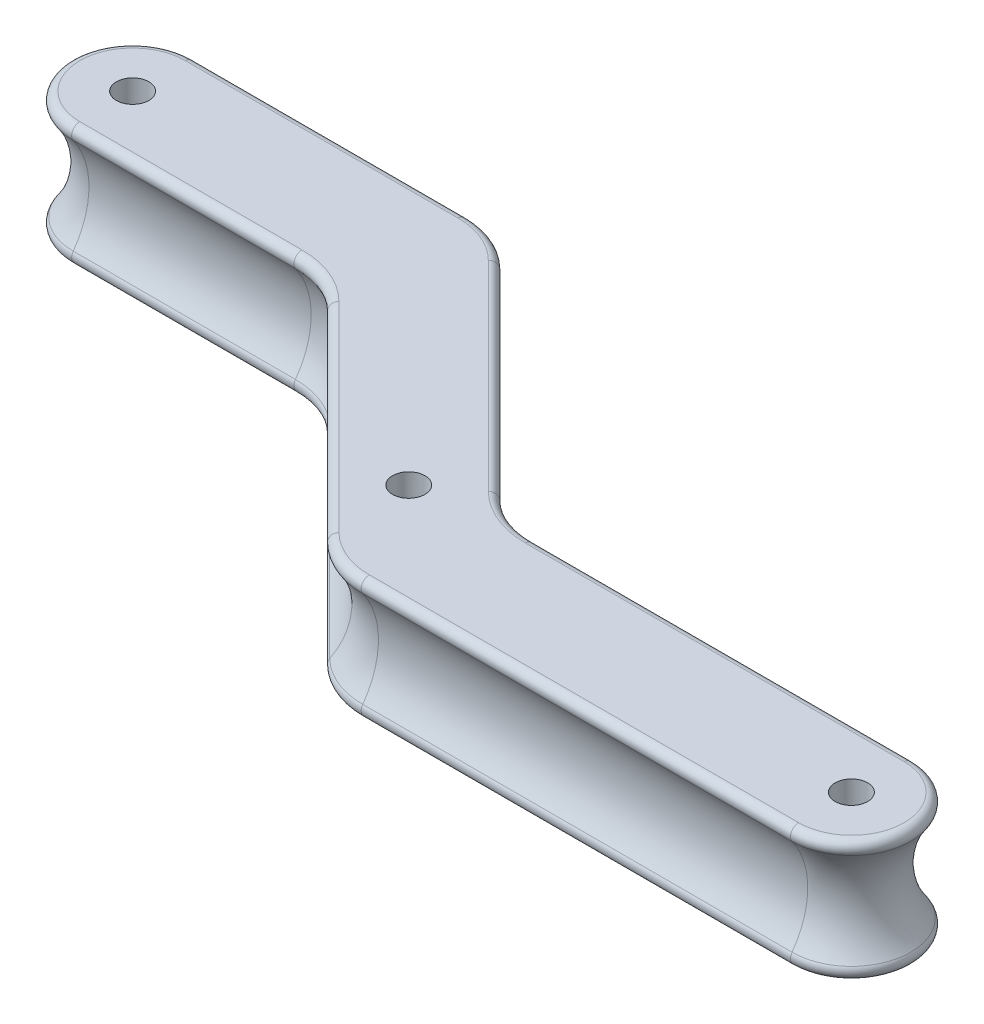
from build123d import *

# Parameters (mm, degrees)
EXTRUDE_1_DEPTH     = 7.5
SKETCH_2_R          = 2
CUT_EXTRUDE_1_DEPTH = 195.977562812
FILLET_1_R          = 10


with BuildPart() as part:
    # 草图1 → 凸台-拉伸1 (new, symmetric)
    with BuildSketch(Plane(origin=(0, 0, 0), x_dir=(1, 0, 0), z_dir=(0, 1, 0))):
        with BuildLine():
            Line((-181.5, 30.5), (-150, 30.5))
            Line((-150, 30.5), (-119.5, 0))
            Line((-119.5, 0), (-62.5, 0))
            ThreePointArc((-62.5, 0), (-55, 7.5), (-62.5, 15))
            Line((-62.5, 15), (-113.286796564, 15))
            Line((-113.286796564, 15), (-143.786796564, 45.5))
            Line((-143.786796564, 45.5), (-181.5, 45.5))
            ThreePointArc((-181.5, 45.5), (-189, 38), (-181.5, 30.5))
        make_face()
    extrude(amount=EXTRUDE_1_DEPTH, both=True)

    # 草图2 → 切除-拉伸1 (cut, through all)
    with BuildSketch(Plane(origin=(0, 7.5, 0), x_dir=(1, 0, 0), z_dir=(0, 1, 0))):
        with Locations(Location((-62.5, 7.5, 0), (0, 0, 270))):
            Circle(SKETCH_2_R)
        with Locations(Location((-181.5, 38, 0), (0, 0, 270))):
            Circle(SKETCH_2_R)
        with Locations(Location((-122.5, 13, 0), (0, 0, 270))):
            Circle(SKETCH_2_R)
    extrude(amount=-CUT_EXTRUDE_1_DEPTH, mode=Mode.SUBTRACT)

    # 圆角1
    fillet_1_edges = [part.edges().sort_by_distance(p)[0] for p in [
        (-143.786796564, 0, -45.5),
        (-113.286796564, 0, -15),
        (-119.5, 0, 0),
        (-150, 0, -30.5),
    ]]
    fillet(fillet_1_edges, radius=FILLET_1_R)

    # 切除-扫描1: sweep along a path in 草图4
    with BuildLine(Plane(origin=(0, 7.5, 0), x_dir=(1, 0, 0), z_dir=(0, 1, 0))) as sweep_1_path:
        Line((-62.5, 15), (-109.144660941, 15))
        ThreePointArc((-109.144660941, 15), (-112.971495264, 15.761204675), (-116.215728753, 17.928932188))
        Line((-116.215728753, 17.928932188), (-140.857864376, 42.571067812))
        ThreePointArc((-140.857864376, 42.571067812), (-144.102097864, 44.738795325), (-147.928932188, 45.5))
        Line((-147.928932188, 45.5), (-181.5, 45.5))
        ThreePointArc((-181.5, 45.5), (-189, 38), (-181.5, 30.5))
        Line((-181.5, 30.5), (-154.142135624, 30.5))
        ThreePointArc((-154.142135624, 30.5), (-150.3153013, 29.738795325), (-147.071067812, 27.571067812))
        Line((-147.071067812, 27.571067812), (-122.428932188, 2.928932188))
        ThreePointArc((-122.428932188, 2.928932188), (-119.1846987, 0.761204675), (-115.357864376, 0))
        Line((-115.357864376, 0), (-62.5, 0))
        ThreePointArc((-62.5, 0), (-55, 7.5), (-62.5, 15))
    # 草图5 → 切除-扫描1 (sweep, cut)
    with BuildSketch(Plane(origin=(-62.5, 0, 0), x_dir=(0, 0, -1), z_dir=(1, 0, 0))):
        with BuildLine():
            Line((1, 7.5), (-4, 7.5))
            Line((-4, 7.5), (-4, -7.5))
            Line((-4, -7.5), (1, -7.5))
            ThreePointArc((1, -7.5), (0.108117415, -6.952267017), (0.193261848, -5.909090909))
            ThreePointArc((0.193261848, -5.909090909), (2.125880325, 0), (0.193261848, 5.909090909))
            ThreePointArc((0.193261848, 5.909090909), (0.108117415, 6.952267017), (1, 7.5))
        make_face()
    sweep(path=sweep_1_path.line, mode=Mode.SUBTRACT)


solid = part.part
